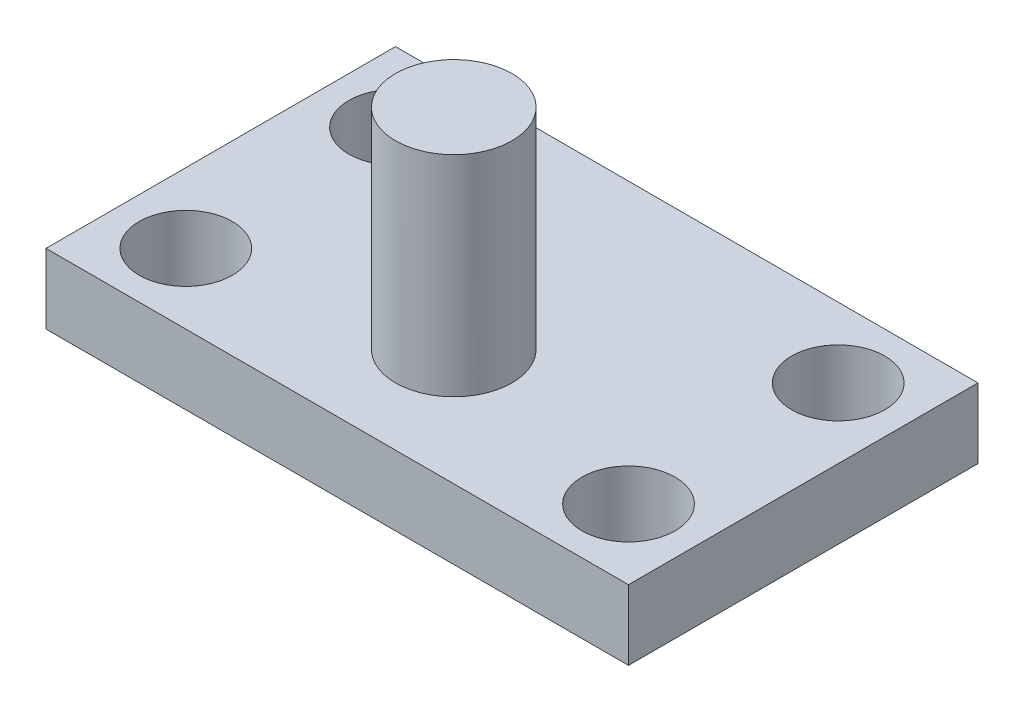
from build123d import *

# Parameters (mm, degrees)
SKETCH1_W           = 250
SKETCH1_H           = 150
SKETCH1_R           = 25
SKETCH1_R_2         = 20
BOSS_EXTRUDE1_DEPTH = 30
SKETCH2_R           = 25
BOSS_EXTRUDE2_DEPTH = 120


with BuildPart() as part:
    # Sketch1 → Boss-Extrude1 (new body)
    with BuildSketch(Plane(origin=(0, 0, 0), x_dir=(1, 0, 0), z_dir=(0, 1, 0))):
        Rectangle(SKETCH1_W, SKETCH1_H)
        with Locations(Location((0, -25, 0), (0, 0, 270))):
            Circle(SKETCH1_R, mode=Mode.SUBTRACT)
        with Locations(Location((-95, 45, 0), (0, 0, 270))):
            Circle(SKETCH1_R_2, mode=Mode.SUBTRACT)
        with Locations(Location((-95, -45, 0), (0, 0, 270))):
            Circle(SKETCH1_R_2, mode=Mode.SUBTRACT)
        with Locations(Location((95, -45, 0), (0, 0, 90))):
            Circle(SKETCH1_R_2, mode=Mode.SUBTRACT)
        with Locations(Location((95, 45, 0), (0, 0, 90))):
            Circle(SKETCH1_R_2, mode=Mode.SUBTRACT)
    extrude(amount=BOSS_EXTRUDE1_DEPTH)

    # Sketch2 → Boss-Extrude2 (add)
    with BuildSketch(Plane.XZ):
        with Locations(Location((0, 25, 0), (0, 0, 270))):
            Circle(SKETCH2_R)
    extrude(amount=-BOSS_EXTRUDE2_DEPTH)


solid = part.part
